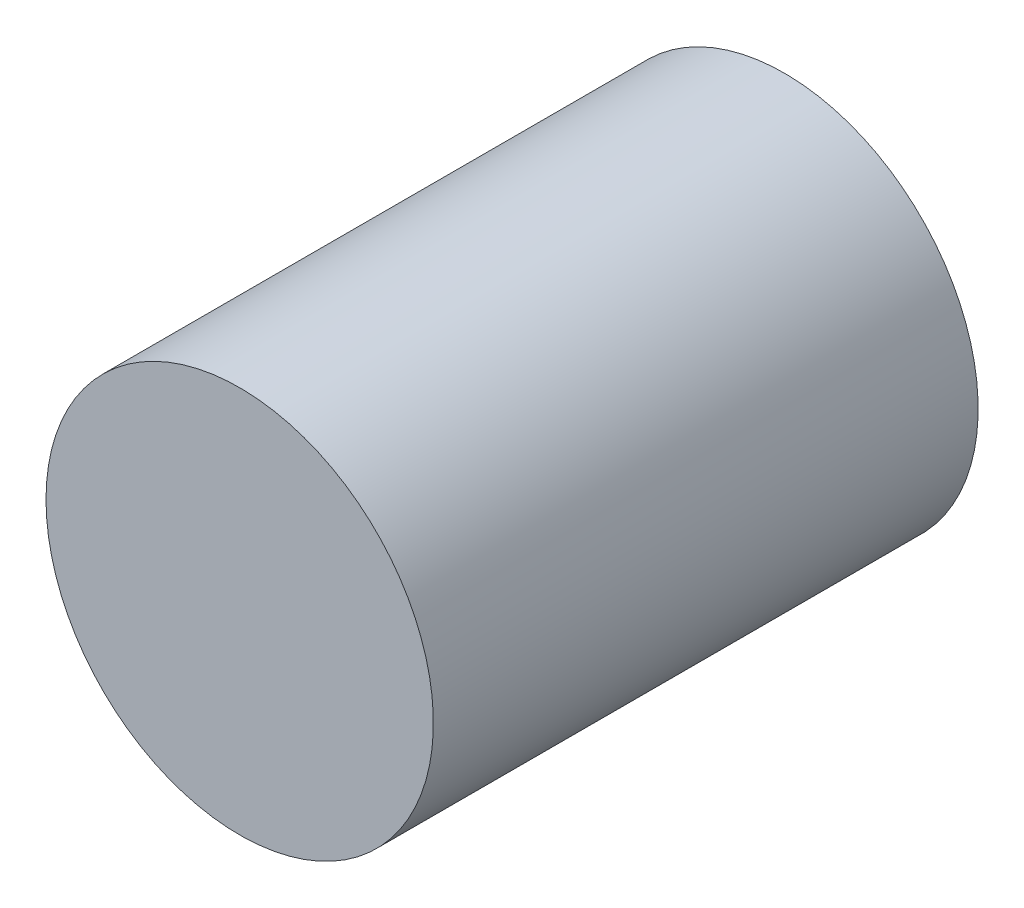
from build123d import *

# Parameters (mm, degrees)
SKETCH_1_R      = 16
EXTRUDE_1_DEPTH = 45


with BuildPart() as part:
    # 草图1 → 凸台-拉伸1 (new body)
    with BuildSketch(Plane.XY):
        with Locations(Location((0, 0, 0), (0, 0, 180))):
            Circle(SKETCH_1_R)
    extrude(amount=EXTRUDE_1_DEPTH)


solid = part.part
